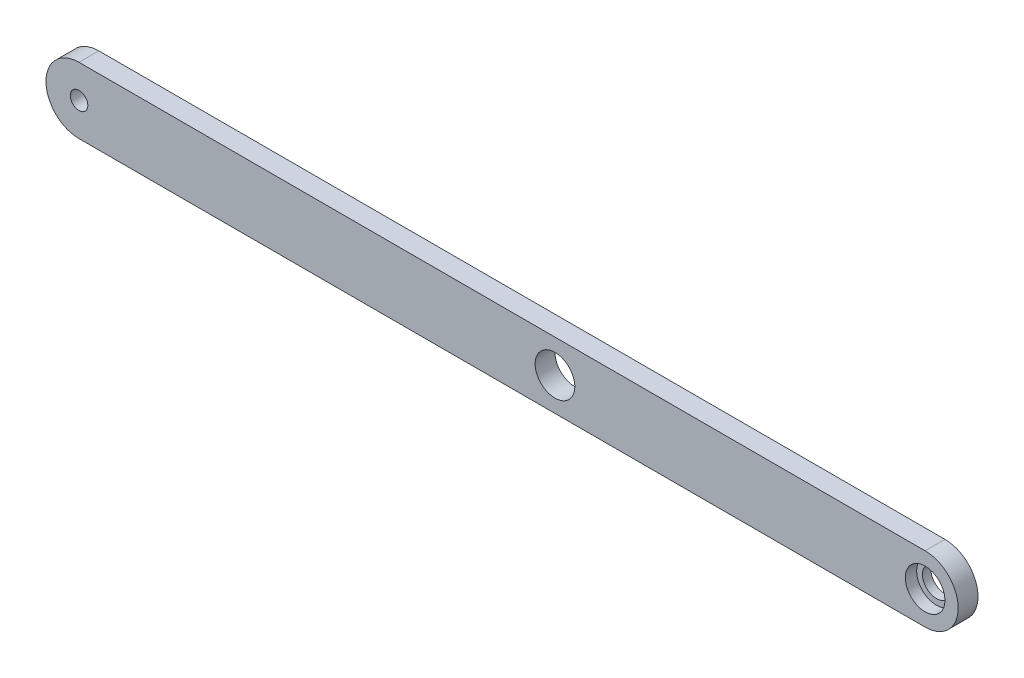
from build123d import *

# Parameters (mm, degrees)
SKETCH1_R                 = 4.7625
BOSS_EXTRUDE1_DEPTH       = 4.7625
SKETCH1_3_R               = 4.7625
SKETCH1_3_R_2             = 3.3734375
BOSS_EXTRUDE2_DEPTH       = 2.032
M5X0_8_TAPPED_HOLE1_D     = 4.2
M5X0_8_TAPPED_HOLE1_DEPTH = 11.1333927
M5X0_8_TAPPED_HOLE1_TIP   = 1.2618073


with BuildPart() as part:
    # Sketch1 → Boss-Extrude1 (new body)
    with BuildSketch(Plane.XY):
        with BuildLine():
            Line((101.6, 7.9375), (-101.6, 7.9375))
            ThreePointArc((-101.6, 7.9375), (-109.5375, 0), (-101.6, -7.9375))
            Line((-101.6, -7.9375), (101.6, -7.9375))
            ThreePointArc((101.6, -7.9375), (109.5375, 0), (101.6, 7.9375))
        make_face()
        with Locations((12.7, 0)):
            Circle(SKETCH1_R, mode=Mode.SUBTRACT)
        with Locations((101.6, 0)):
            Circle(SKETCH1_R, mode=Mode.SUBTRACT)
    extrude(amount=BOSS_EXTRUDE1_DEPTH)

    # Sketch1<3> → Boss-Extrude2 (add)
    with BuildSketch(Plane.XY):
        with Locations((101.6, 0)):
            Circle(SKETCH1_3_R)
        with Locations((101.6, 0)):
            Circle(SKETCH1_3_R_2, mode=Mode.SUBTRACT)
    extrude(amount=BOSS_EXTRUDE2_DEPTH)

    # M5x0.8 Tapped Hole1
    with Locations(Plane.XY.offset(4.7625)):
        with Locations((-101.6, 0)):
            Hole(M5X0_8_TAPPED_HOLE1_D / 2, depth=M5X0_8_TAPPED_HOLE1_DEPTH)
            with Locations((0, 0, -(M5X0_8_TAPPED_HOLE1_DEPTH + M5X0_8_TAPPED_HOLE1_TIP / 2))):  # 118° drill point
                Cone(0, M5X0_8_TAPPED_HOLE1_D / 2, M5X0_8_TAPPED_HOLE1_TIP, mode=Mode.SUBTRACT)


solid = part.part
